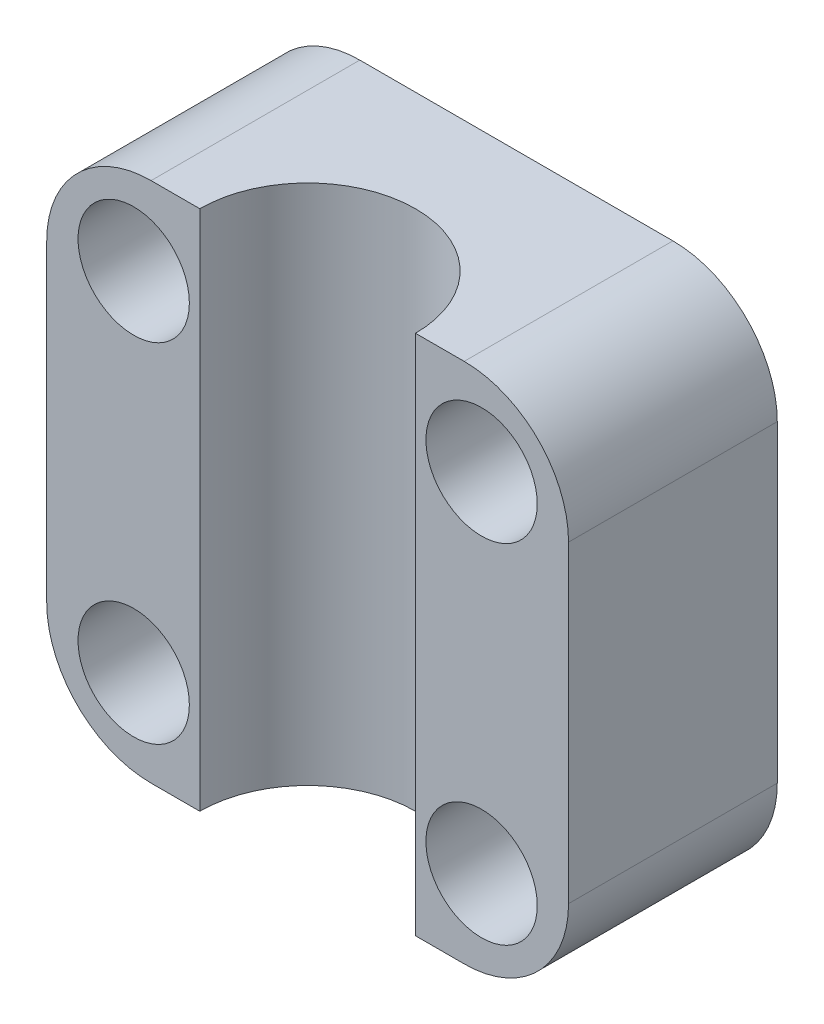
from build123d import *

# Parameters (mm, degrees)
SKIZZE1_W                            = 15
SKIZZE1_H                            = 15
SKIZZE1_R                            = 1.6
AUFSATZ_LINEAR_AUSTRAGEN1_DEPTH      = 6
SCHNITT_LINEAR_AUSTRAGEN1_DEPTH      = 13.186057607
SCHNITT_LINEAR_AUSTRAGEN1_DEPTH_BACK = 13.186057607
SKIZZE2_R                            = 3.1
VERRUNDUNG1_R                        = 3


with BuildPart() as part:
    # Skizze1 → Aufsatz-Linear austragen1 (new body)
    with BuildSketch(Plane.XY):
        Rectangle(SKIZZE1_W, SKIZZE1_H)
        with Locations((5, 5)):
            Circle(SKIZZE1_R, mode=Mode.SUBTRACT)
        with Locations((-5, 5)):
            Circle(SKIZZE1_R, mode=Mode.SUBTRACT)
        with Locations((-5, -5)):
            Circle(SKIZZE1_R, mode=Mode.SUBTRACT)
        with Locations((5, -5)):
            Circle(SKIZZE1_R, mode=Mode.SUBTRACT)
    extrude(amount=-AUFSATZ_LINEAR_AUSTRAGEN1_DEPTH)

    # Skizze2 → Schnitt-Linear austragen1 (cut, two sides: drawn at the far end of the back side and taken through both)
    with BuildSketch(Plane(origin=(0, 0, 0), x_dir=(1, 0, 0), z_dir=(0, 1, 0)).offset(-SCHNITT_LINEAR_AUSTRAGEN1_DEPTH_BACK)):
        Circle(SKIZZE2_R)
    extrude(amount=SCHNITT_LINEAR_AUSTRAGEN1_DEPTH + SCHNITT_LINEAR_AUSTRAGEN1_DEPTH_BACK, mode=Mode.SUBTRACT)

    # Verrundung1
    verrundung1_edges = [part.edges().sort_by_distance(p)[0] for p in [
        (-7.5, 7.5, -3),
        (7.5, 7.5, -3),
        (7.5, -7.5, -3),
        (-7.5, -7.5, -3),
    ]]
    fillet(verrundung1_edges, radius=VERRUNDUNG1_R)


solid = part.part
